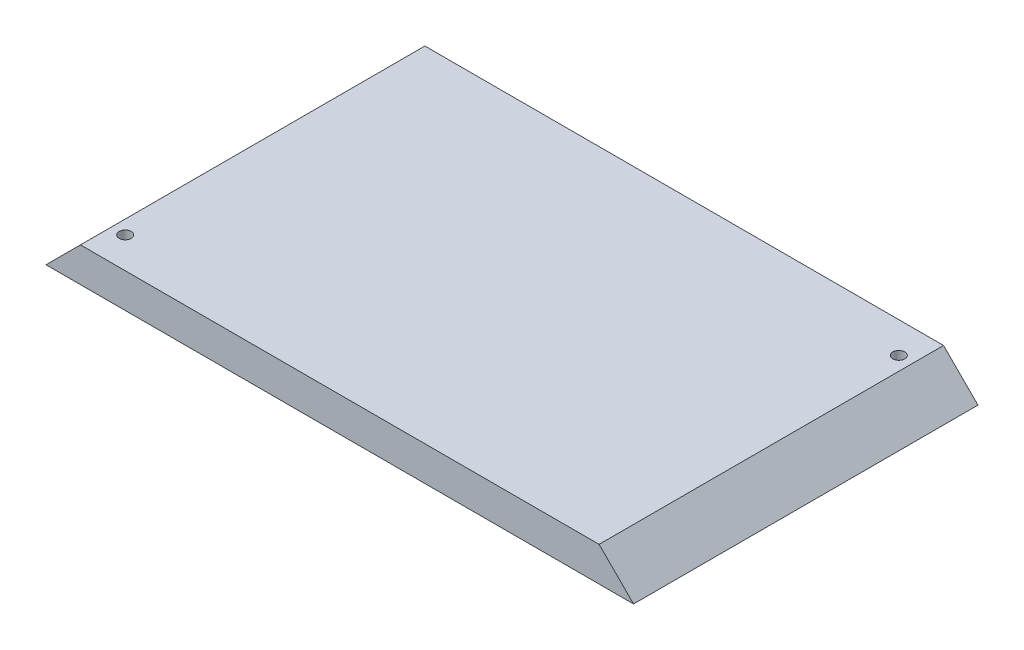
from build123d import *

# Parameters (mm, degrees)
SKETCH3_W           = 150.58
SKETCH3_H           = 100
BOSS_EXTRUDE1_DEPTH = 10
DRAFT1_ANGLE        = 45
SKETCH4_R           = 1.75
CUT_EXTRUDE1_DEPTH  = 15


with BuildPart() as part:
    # Sketch3 → Boss-Extrude1 (new body)
    with BuildSketch(Plane(origin=(0, 0, 0), x_dir=(1, 0, 0), z_dir=(0, 1, 0))):
        with Locations((-1.73528017, -24.11217163)):
            Rectangle(SKETCH3_W, SKETCH3_H)
    extrude(amount=BOSS_EXTRUDE1_DEPTH)

    # Draft1
    draft1_faces = [part.faces().sort_by_distance(p)[0] for p in [
        (73.55471983, 5, 24.11217163),
        (-77.02528017, 5, 24.11217163),
    ]]
    draft(draft1_faces, Plane.ZX.offset(10), DRAFT1_ANGLE)

    # Sketch4 → Cut-Extrude1 (cut)
    with BuildSketch(Plane(origin=(0, 10, 0), x_dir=(1, 0, 0), z_dir=(0, 1, 0))):
        with Locations(Location((69.55471983, 16.88782837, 0), (0, 0, 270))):
            Circle(SKETCH4_R)
        with Locations(Location((-73.02528017, -65.11217163, 0), (0, 0, 270))):
            Circle(SKETCH4_R)
    extrude(amount=-CUT_EXTRUDE1_DEPTH, mode=Mode.SUBTRACT)


solid = part.part
